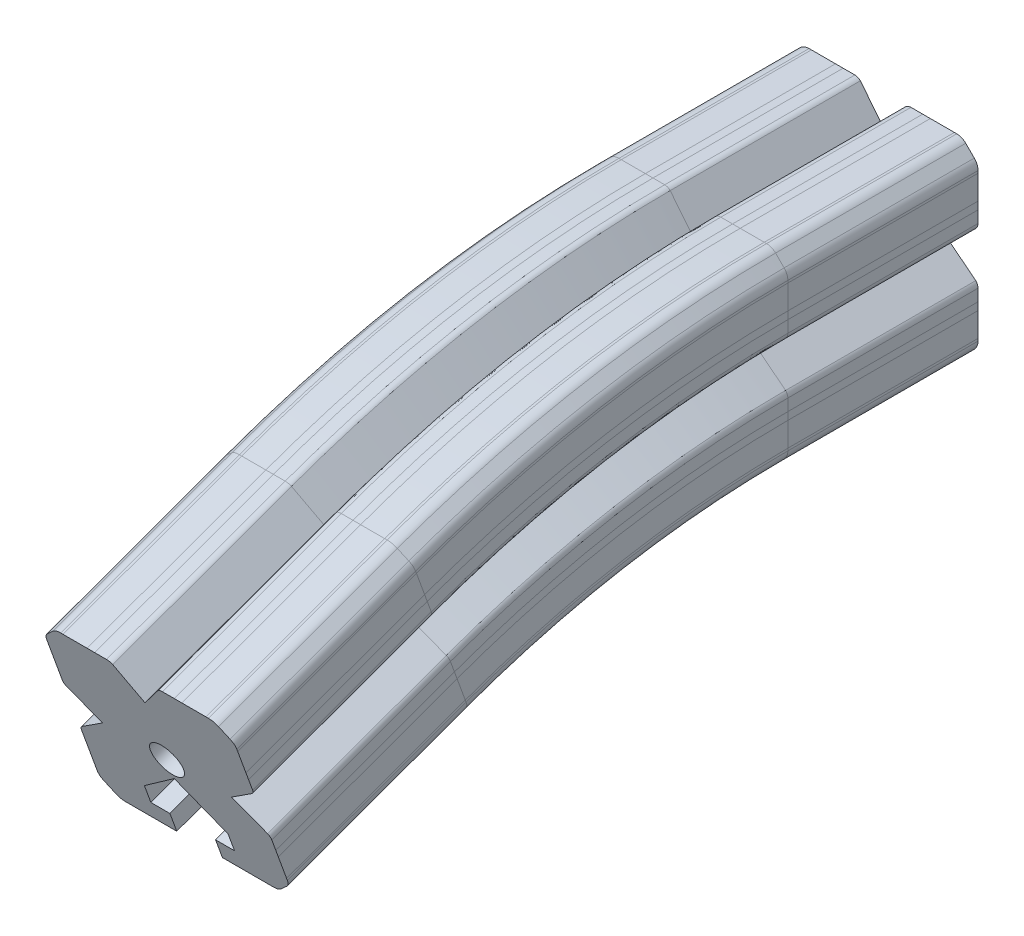
from build123d import *

# Parameters (mm, degrees)
SKETCH12_R         = 3.3274
CUT_EXTRUDE3_DEPTH = 16.51
SKETCH18_R         = 3.3274
CUT_EXTRUDE5_DEPTH = 16.51
CUT_EXTRUDE6_DEPTH = 38.1
CUT_EXTRUDE7_DEPTH = 38.1
FILLET1_R          = 2.54


with BuildPart() as part:
    # Sweep4: sweep along a path in Sketch2
    with BuildLine(Plane(origin=(0, 0, 0), x_dir=(0, -1, 0), z_dir=(1, 0, 0))) as sweep4_path:
        Line((0, 304.8), (0, 266.7))
        ThreePointArc((0, 266.7), (3.087064588, 231.414690298), (12.254459456, 197.201506876))
        Line((12.254459456, 197.201506876), (25.285426917, 161.399218024))
    # Sketch1 → Sweep4 (sweep)
    with BuildSketch(Plane(origin=(0, 0, -304.8), x_dir=(-1, 0, 0), z_dir=(0, 0, -1))):
        with BuildLine():
            Line((14.327719385, 19.117037436), (9.498178882, 19.117037436))
            Line((9.498178882, 19.117037436), (7.974178882, 19.117037436))
            Line((7.974178882, 19.117037436), (5.617617743, 19.117037436))
            add(Edge.make_bspline(
                [(4.519044239, 18.661993391), (4.974146533, 19.106441591), (5.617617743, 19.117037436)],
                knots=[0, 0, 0, 1, 1, 1], degree=2))
            Line((4.519044239, 18.661993391), (1.94e-07, 12.981797177))
            Line((1.94e-07, 12.981797177), (-4.519043851, 18.661993391))
            add(Edge.make_bspline(
                [(-4.519043851, 18.661993391), (-4.974146145, 19.106441591), (-5.617617355, 19.117037436)],
                knots=[0, 0, 0, 1, 1, 1], degree=2))
            Line((-5.617617355, 19.117037436), (-7.974178525, 19.117037436))
            Line((-7.974178525, 19.117037436), (-9.498178525, 19.117037436))
            Line((-9.498178525, 19.117037436), (-14.327719028, 19.117037436))
            Line((-14.327719028, 19.117037436), (-15.847486861, 19.117037436))
            Line((-15.847486861, 19.117037436), (-19.049999993, 15.914546869))
            Line((-19.049999993, 15.914546869), (-19.049999993, 14.394779143))
            Line((-19.049999993, 14.394779143), (-19.049999993, 9.563129129))
            Line((-19.049999993, 9.563129129), (-19.049999993, 8.043361318))
            Line((-19.049999993, 8.043361318), (-19.049999993, 5.684655209))
            add(Edge.make_bspline(
                [(-18.594955948, 4.586081704), (-19.037616587, 5.0374273), (-19.049999993, 5.684655209)],
                knots=[0, 0, 0, 1, 1, 1], degree=2))
            Line((-18.594955948, 4.586081704), (-12.87844311, 0.067037659))
            Line((-12.87844311, 0.067037659), (-18.594955948, -4.452006385))
            add(Edge.make_bspline(
                [(-18.594955948, -4.452006385), (-19.041321191, -4.911567946), (-19.049999993, -5.55057989)],
                knots=[0, 0, 0, 1, 1, 1], degree=2))
            Line((-19.049999993, -5.55057989), (-19.049999993, -7.909280831))
            Line((-19.049999993, -7.909280831), (-19.049999993, -9.429048642))
            Line((-19.049999993, -9.429048642), (-19.049999993, -14.26070525))
            Line((-19.049999993, -14.26070525), (-19.049999993, -15.78047301))
            Line((-19.049999993, -15.78047301), (-15.847487724, -18.982963187))
            Line((-15.847487724, -18.982963187), (-14.327719934, -18.982963187))
            Line((-14.327719934, -18.982963187), (-9.496063347, -18.982963187))
            Line((-9.496063347, -18.982963187), (-7.976295515, -18.982963187))
            Line((-7.976295515, -18.982963187), (-5.617618448, -18.982963187))
            Line((-5.617618448, -18.982963187), (5.61761665, -18.982963187))
            Line((5.61761665, -18.982963187), (7.976293717, -18.982963187))
            Line((7.976293717, -18.982963187), (9.49606155, -18.982963187))
            Line((9.49606155, -18.982963187), (14.327718136, -18.982963187))
            Line((14.327718136, -18.982963187), (15.847485969, -18.982963187))
            Line((15.847485969, -18.982963187), (19.049999872, -15.780473094))
            Line((19.049999872, -15.780473094), (19.049999872, -14.260705341))
            Line((19.049999872, -14.260705341), (19.049999872, -9.429048733))
            Line((19.049999872, -9.429048733), (19.049999872, -7.909280921))
            Line((19.049999872, -7.909280921), (19.049999872, -5.55057989))
            add(Edge.make_bspline(
                [(18.594955827, -4.452006385), (19.032827661, -4.894662271), (19.049999872, -5.55057989)],
                knots=[0, 0, 0, 1, 1, 1], degree=2))
            Line((18.594955827, -4.452006385), (12.878443126, 0.067037659))
            Line((12.878443126, 0.067037659), (18.50654198, 4.504271816))
            add(Edge.make_bspline(
                [(18.50654198, 4.504271816), (19.035090049, 4.971481948), (19.049999872, 5.684655209)],
                knots=[0, 0, 0, 1, 1, 1], degree=2))
            Line((19.049999872, 5.684655209), (19.049999872, 8.043361226))
            Line((19.049999872, 8.043361226), (19.049999872, 9.563129038))
            Line((19.049999872, 9.563129038), (19.049999872, 14.394779052))
            Line((19.049999872, 14.394779052), (19.049999872, 15.914546875))
            Line((19.049999872, 15.914546875), (15.847487218, 19.117037436))
            Line((15.847487218, 19.117037436), (14.327719385, 19.117037436))
        make_face()
    sweep(path=sweep4_path.line)

    # Sketch12 → Cut-Extrude3 (cut)
    with BuildSketch(Plane(origin=(0, 0, -304.8), x_dir=(-1, 0, 0), z_dir=(0, 0, -1))):
        with Locations((8e-09, 0.067037659)):
            Circle(SKETCH12_R)
    extrude(amount=-CUT_EXTRUDE3_DEPTH, mode=Mode.SUBTRACT)

    # Sketch18 → Cut-Extrude5 (cut)
    with BuildSketch(Plane(origin=(0, 48.914875712, -134.392516494), x_dir=(1, 0, 0), z_dir=(0, -0.3420201433256568, 0.9396926207859128))):
        with Locations(Location((-8e-09, -78.895275109, 0), (0, 0, 270))):
            Circle(SKETCH18_R)
    extrude(amount=-CUT_EXTRUDE5_DEPTH, mode=Mode.SUBTRACT)

    # Sketch20 → Cut-Extrude6 (cut)
    with BuildSketch(Plane(origin=(0, 0, -304.8), x_dir=(-1, 0, 0), z_dir=(0, 0, -1))):
        Polygon((4.572, -18.982963187), (-4.572, -18.982963187), (-4.572, -14.969763187), (-8.382, -14.969763187), (-8.382, -11.159763187), (0, -4.126430078), (8.382, -11.159763187), (8.382, -14.969763187), (4.572, -14.969763187), align=None)
    extrude(amount=-CUT_EXTRUDE6_DEPTH, mode=Mode.SUBTRACT)

    # Sketch21 → Cut-Extrude7 (cut)
    with BuildSketch(Plane(origin=(0, 48.914875712, -134.392516494), x_dir=(1, 0, 0), z_dir=(0, -0.3420201433256568, 0.9396926207859129))):
        Polygon((4.572, -97.945275956), (-4.572, -97.945275956), (-4.572, -93.932075956), (-8.382, -93.932075956), (-8.382, -90.122075956), (0, -83.088742847), (8.382, -90.122075956), (8.382, -93.932075956), (4.572, -93.932075956), align=None)
    extrude(amount=-CUT_EXTRUDE7_DEPTH, mode=Mode.SUBTRACT)

    # Fillet1
    fillet1_edges = [part.edges().sort_by_distance(p)[0] for p in [
        (15.847486861, 19.117037436, -285.75),
        (19.049999993, 15.914546869, -285.75),
        (19.049999993, -15.78047301, -285.75),
        (15.847487724, -18.982963187, -285.75),
        (-15.847485969, -18.982963187, -285.75),
        (-19.049999872, -15.780473094, -285.75),
        (-19.049999872, 15.914546875, -285.75),
        (-15.847487218, 19.117037436, -285.75),
        (15.847486861, 15.739542094, -228.095051585),
        (19.049999993, 12.585704554, -228.651158236),
        (19.049999993, -18.627796755, -234.154940679),
        (15.847487724, -21.781633909, -234.711047262),
        (-15.847485969, -21.781633909, -234.711047262),
        (-19.049999872, -18.627796837, -234.154940694),
        (-19.049999872, 12.58570456, -228.651158235),
        (-15.847487218, 15.739542094, -228.095051585),
        (15.847486861, -0.805804177, -172.761950566),
        (19.049999993, -3.815160931, -173.857266849),
        (19.049999993, -33.598737227, -184.697602091),
        (15.847487724, -36.608093614, -185.79291824),
        (-15.847485969, -36.608093614, -185.79291824),
        (-19.049999872, -33.598737305, -184.69760212),
        (-19.049999872, -3.815160926, -173.857266847),
        (-15.847487218, -0.805804177, -172.761950566),
    ]]
    fillet(fillet1_edges, radius=FILLET1_R)


solid = part.part
